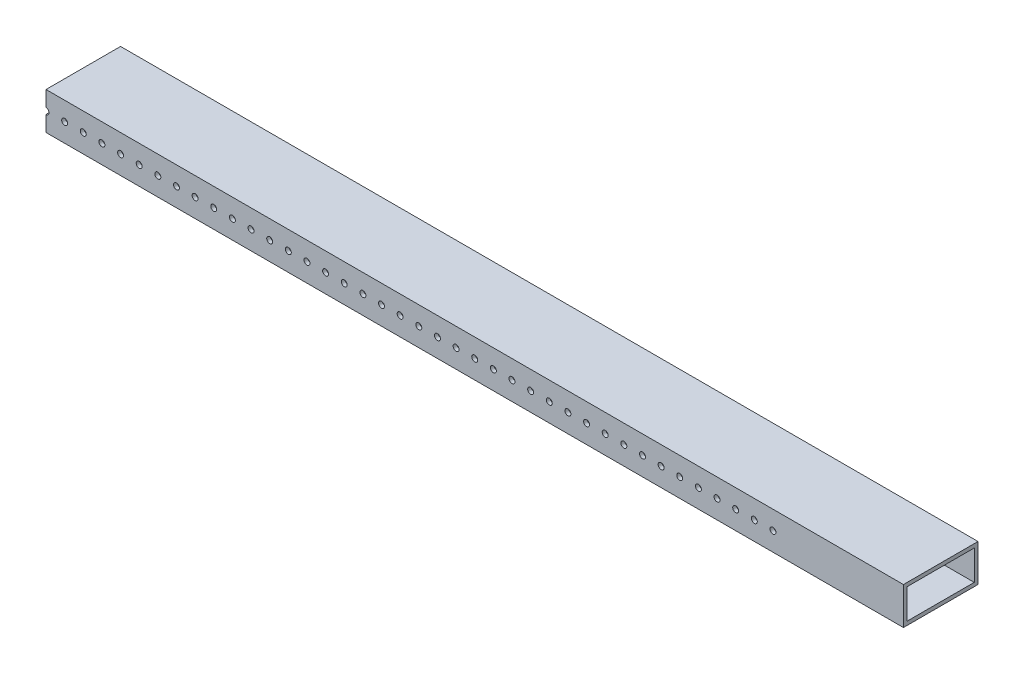
from build123d import *

# Parameters (mm, degrees)
SKETCH1_W           = 50.8
SKETCH1_H           = 25.4
SKETCH1_W_2         = 45.72
SKETCH1_H_2         = 20.32
BOSS_EXTRUDE1_DEPTH = 292.1
SKETCH2_R           = 2.032
CUT_EXTRUDE1_DEPTH  = 297.756364717


with BuildPart() as part:
    # Sketch1 → Boss-Extrude1 (new, symmetric)
    with BuildSketch(Plane(origin=(0, 0, 0), x_dir=(0, 0, -1), z_dir=(1, 0, 0))):
        Rectangle(SKETCH1_W, SKETCH1_H)
        Rectangle(SKETCH1_W_2, SKETCH1_H_2, mode=Mode.SUBTRACT)
    extrude(amount=BOSS_EXTRUDE1_DEPTH, both=True)

    # Sketch2 → Cut-Extrude1 (cut, through all)
    with BuildSketch(Plane.XY.offset(25.4)):
        with Locations((-292.1, 0)):
            Circle(SKETCH2_R)
        with Locations((-279.4, 0)):
            Circle(SKETCH2_R)
        with Locations((-266.7, 0)):
            Circle(SKETCH2_R)
        with Locations((-254, 0)):
            Circle(SKETCH2_R)
        with Locations((-241.3, 0)):
            Circle(SKETCH2_R)
        with Locations((-228.6, 0)):
            Circle(SKETCH2_R)
        with Locations((-215.9, 0)):
            Circle(SKETCH2_R)
        with Locations((-203.2, 0)):
            Circle(SKETCH2_R)
        with Locations((-190.5, 0)):
            Circle(SKETCH2_R)
        with Locations((-177.8, 0)):
            Circle(SKETCH2_R)
        with Locations((-165.1, 0)):
            Circle(SKETCH2_R)
        with Locations((-152.4, 0)):
            Circle(SKETCH2_R)
        with Locations((-139.7, 0)):
            Circle(SKETCH2_R)
        with Locations((-127, 0)):
            Circle(SKETCH2_R)
        with Locations((-114.3, 0)):
            Circle(SKETCH2_R)
        with Locations((-101.6, 0)):
            Circle(SKETCH2_R)
        with Locations((-88.9, 0)):
            Circle(SKETCH2_R)
        with Locations((-76.2, 0)):
            Circle(SKETCH2_R)
        with Locations((-63.5, 0)):
            Circle(SKETCH2_R)
        with Locations((-50.8, 0)):
            Circle(SKETCH2_R)
        with Locations((-38.1, 0)):
            Circle(SKETCH2_R)
        with Locations((-25.4, 0)):
            Circle(SKETCH2_R)
        with Locations((-12.7, 0)):
            Circle(SKETCH2_R)
        Circle(SKETCH2_R)
        with Locations((12.7, 0)):
            Circle(SKETCH2_R)
        with Locations((25.4, 0)):
            Circle(SKETCH2_R)
        with Locations((38.1, 0)):
            Circle(SKETCH2_R)
        with Locations((50.8, 0)):
            Circle(SKETCH2_R)
        with Locations((63.5, 0)):
            Circle(SKETCH2_R)
        with Locations((76.2, 0)):
            Circle(SKETCH2_R)
        with Locations((88.9, 0)):
            Circle(SKETCH2_R)
        with Locations((101.6, 0)):
            Circle(SKETCH2_R)
        with Locations((114.3, 0)):
            Circle(SKETCH2_R)
        with Locations((127, 0)):
            Circle(SKETCH2_R)
        with Locations((139.7, 0)):
            Circle(SKETCH2_R)
        with Locations((152.4, 0)):
            Circle(SKETCH2_R)
        with Locations((165.1, 0)):
            Circle(SKETCH2_R)
        with Locations((177.8, 0)):
            Circle(SKETCH2_R)
        with Locations((190.5, 0)):
            Circle(SKETCH2_R)
        with Locations((203.2, 0)):
            Circle(SKETCH2_R)
    extrude(amount=-CUT_EXTRUDE1_DEPTH, mode=Mode.SUBTRACT)


solid = part.part
